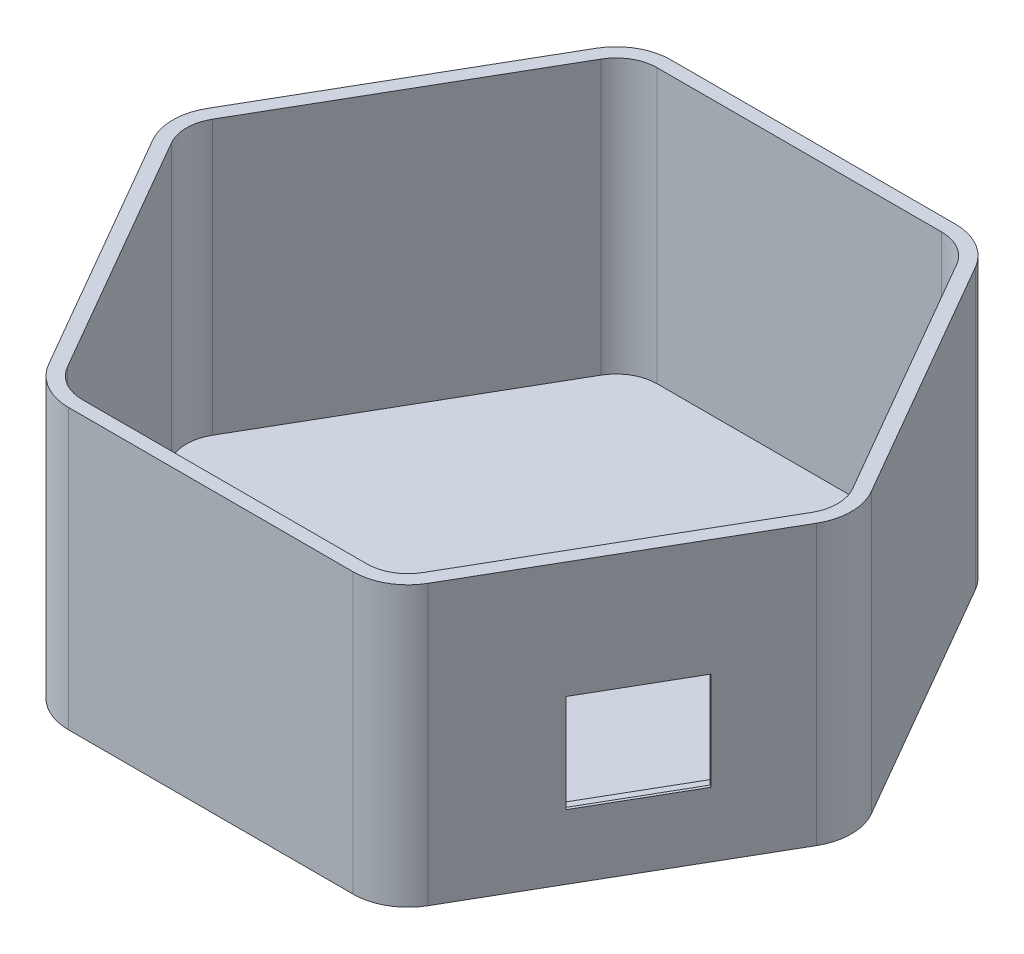
from build123d import *

# Parameters (mm, degrees)
SALIENTE_EXTRUIR1_DEPTH = 2
SALIENTE_EXTRUIR2_DEPTH = 100
CROQUIS3_W              = 58.7
CROQUIS3_H              = 38.2
CROQUIS3_R              = 1.5
CROQUIS3_W_2            = 38.8
CROQUIS3_H_2            = 35.8
CORTAR_EXTRUIR1_DEPTH   = 1
CROQUIS4_W              = 38.8
CROQUIS4_H              = 35.8
CORTAR_EXTRUIR2_DEPTH   = 12
CROQUIS5_W              = 58.7
CROQUIS5_H              = 38.2
CROQUIS5_R              = 1.5
CORTAR_EXTRUIR3_DEPTH   = 3
CROQUIS6_R              = 1
SALIENTE_EXTRUIR3_DEPTH = 3.4
CROQUIS8_R              = 1
CORTAR_EXTRUIR5_DEPTH   = 4
CORTAR_EXTRUIR6_DEPTH   = 0.6


with BuildPart() as part:
    # Croquis1 → Saliente-Extruir1 (new body)
    with BuildSketch(Plane(origin=(0, 0, 0), x_dir=(1, 0, 0), z_dir=(0, 1, 0))):
        with BuildLine():
            Line((-121.24355653, -10), (-69.282032303, -100))
            ThreePointArc((-69.282032303, -100), (-61.961524227, -107.320508076), (-51.961524227, -110))
            Line((-51.961524227, -110), (51.961524227, -110))
            ThreePointArc((51.961524227, -110), (61.961524227, -107.320508076), (69.282032303, -100))
            Line((69.282032303, -100), (121.24355653, -10))
            ThreePointArc((121.24355653, -10), (123.923048454, 0), (121.24355653, 10))
            Line((121.24355653, 10), (69.282032303, 100))
            ThreePointArc((69.282032303, 100), (61.961524227, 107.320508076), (51.961524227, 110))
            Line((51.961524227, 110), (-51.961524227, 110))
            ThreePointArc((-51.961524227, 110), (-61.961524227, 107.320508076), (-69.282032303, 100))
            Line((-69.282032303, 100), (-121.24355653, 10))
            ThreePointArc((-121.24355653, 10), (-123.923048454, 0), (-121.24355653, -10))
        make_face()
    extrude(amount=SALIENTE_EXTRUIR1_DEPTH)

    # Croquis2 → Saliente-Extruir2 (add)
    with BuildSketch(Plane(origin=(0, 2, 0), x_dir=(1, 0, 0), z_dir=(0, 1, 0))):
        with BuildLine():
            Line((-69.282032303, 100), (-121.24355653, 10))
            ThreePointArc((-121.24355653, 10), (-123.923048454, 0), (-121.24355653, -10))
            Line((-121.24355653, -10), (-69.282032303, -100))
            ThreePointArc((-69.282032303, -100), (-61.961524227, -107.320508076), (-51.961524227, -110))
            Line((-51.961524227, -110), (51.961524227, -110))
            ThreePointArc((51.961524227, -110), (61.961524227, -107.320508076), (69.282032303, -100))
            Line((69.282032303, -100), (121.24355653, -10))
            ThreePointArc((121.24355653, -10), (123.923048454, 0), (121.24355653, 10))
            Line((121.24355653, 10), (69.282032303, 100))
            ThreePointArc((69.282032303, 100), (61.961524227, 107.320508076), (51.961524227, 110))
            Line((51.961524227, 110), (-51.961524227, 110))
            ThreePointArc((-51.961524227, 110), (-61.961524227, 107.320508076), (-69.282032303, 100))
        make_face()
        with BuildLine():
            Line((-64.951905284, 97.5), (-116.913429511, 7.5))
            ThreePointArc((-116.913429511, 7.5), (-118.923048454, 0), (-116.913429511, -7.5))
            Line((-116.913429511, -7.5), (-64.951905284, -97.5))
            ThreePointArc((-64.951905284, -97.5), (-59.461524227, -102.990381057), (-51.961524227, -105))
            Line((-51.961524227, -105), (51.961524227, -105))
            ThreePointArc((51.961524227, -105), (59.461524227, -102.990381057), (64.951905284, -97.5))
            Line((64.951905284, -97.5), (116.913429511, -7.5))
            ThreePointArc((116.913429511, -7.5), (118.923048454, 0), (116.913429511, 7.5))
            Line((116.913429511, 7.5), (64.951905284, 97.5))
            ThreePointArc((64.951905284, 97.5), (59.461524227, 102.990381057), (51.961524227, 105))
            Line((51.961524227, 105), (-51.961524227, 105))
            ThreePointArc((-51.961524227, 105), (-59.461524227, 102.990381057), (-64.951905284, 97.5))
        make_face(mode=Mode.SUBTRACT)
    extrude(amount=SALIENTE_EXTRUIR2_DEPTH)

    # Croquis3 → Cortar-Extruir1 (cut)
    with BuildSketch(Plane(origin=(90.932667397, 0, 52.5), x_dir=(-0.49999999999999983, 0, 0.8660254037844387), z_dir=(-0.8660254037844387, 0, -0.49999999999999983))):
        with Locations((-1.426190801, 41.535179267)):
            Rectangle(CROQUIS3_W, CROQUIS3_H)
        with Locations((24.923809199, 57.635179267)):
            Circle(CROQUIS3_R, mode=Mode.SUBTRACT)
        with Locations((24.923809199, 25.435179267)):
            Circle(CROQUIS3_R, mode=Mode.SUBTRACT)
        with Locations((-27.776190801, 25.435179267)):
            Circle(CROQUIS3_R, mode=Mode.SUBTRACT)
        with Locations((-27.776190801, 57.635179267)):
            Circle(CROQUIS3_R, mode=Mode.SUBTRACT)
        with Locations((-4.376190801, 41.535179267)):
            Rectangle(CROQUIS3_W_2, CROQUIS3_H_2, mode=Mode.SUBTRACT)
    extrude(amount=-CORTAR_EXTRUIR1_DEPTH, mode=Mode.SUBTRACT)

    # Croquis4 → Cortar-Extruir2 (cut)
    with BuildSketch(Plane(origin=(90.932667397, 0, 52.5), x_dir=(-0.49999999999999983, 0, 0.8660254037844387), z_dir=(-0.8660254037844387, 0, -0.49999999999999983))):
        with Locations((-4.376190801, 41.535179267)):
            Rectangle(CROQUIS4_W, CROQUIS4_H)
    extrude(amount=-CORTAR_EXTRUIR2_DEPTH, mode=Mode.SUBTRACT)

    # Croquis5 → Cortar-Extruir3 (cut)
    with BuildSketch(Plane(origin=(91.798692801, 0, 53), x_dir=(-0.5, 0, 0.8660254037844386), z_dir=(-0.8660254037844387, 0, -0.5000000000000001))):
        with Locations((-1.426190801, 41.535179267)):
            Rectangle(CROQUIS5_W, CROQUIS5_H)
        with Locations((24.923809199, 25.435179267)):
            Circle(CROQUIS5_R, mode=Mode.SUBTRACT)
        with Locations((24.923809199, 57.635179267)):
            Circle(CROQUIS5_R, mode=Mode.SUBTRACT)
        with Locations((-27.776190801, 57.635179267)):
            Circle(CROQUIS5_R, mode=Mode.SUBTRACT)
        with Locations((-27.776190801, 25.435179267)):
            Circle(CROQUIS5_R, mode=Mode.SUBTRACT)
    extrude(amount=-CORTAR_EXTRUIR3_DEPTH, mode=Mode.SUBTRACT)

    # Croquis6 → Saliente-Extruir3 (add)
    # profile 1 of 4: a face of its own
    with BuildSketch(Plane(origin=(94.396769013, 0, 54.5), x_dir=(-0.5000000000000001, 0, 0.8660254037844386), z_dir=(-0.8660254037844386, 0, -0.5000000000000001))):
        with BuildLine():
            Line((-30.776190801, 60.635179267), (-25.776190801, 60.635179267))
            Line((-25.776190801, 60.635179267), (-25.776190801, 56.635179267))
            ThreePointArc((-25.776190801, 56.635179267), (-26.06908402, 55.928072486), (-26.776190801, 55.635179267))
            Line((-26.776190801, 55.635179267), (-30.776190801, 55.635179267))
            Line((-30.776190801, 55.635179267), (-30.776190801, 60.635179267))
        make_face()
        with Locations((-27.776190801, 57.635179267)):
            Circle(CROQUIS6_R, mode=Mode.SUBTRACT)
    # profile 2 of 4: a face of its own
    with BuildSketch(Plane(origin=(94.396769013, 0, 54.5), x_dir=(-0.5000000000000001, 0, 0.8660254037844386), z_dir=(-0.8660254037844386, 0, -0.5000000000000001))):
        with BuildLine():
            Line((-30.776190801, 22.435179267), (-25.776190801, 22.435179267))
            Line((-25.776190801, 22.435179267), (-25.776190801, 26.435179267))
            ThreePointArc((-25.776190801, 26.435179267), (-26.06908402, 27.142286049), (-26.776190801, 27.435179267))
            Line((-26.776190801, 27.435179267), (-30.776190801, 27.435179267))
            Line((-30.776190801, 27.435179267), (-30.776190801, 22.435179267))
        make_face()
        with Locations((-27.776190801, 25.435179267)):
            Circle(CROQUIS6_R, mode=Mode.SUBTRACT)
    # profile 3 of 4: a face of its own
    with BuildSketch(Plane(origin=(94.396769013, 0, 54.5), x_dir=(-0.5000000000000001, 0, 0.8660254037844386), z_dir=(-0.8660254037844386, 0, -0.5000000000000001))):
        with BuildLine():
            Line((27.923809199, 22.435179267), (22.923809199, 22.435179267))
            Line((22.923809199, 22.435179267), (22.923809199, 26.435179267))
            ThreePointArc((22.923809199, 26.435179267), (23.216702418, 27.142286049), (23.923809199, 27.435179267))
            Line((23.923809199, 27.435179267), (27.923809199, 27.435179267))
            Line((27.923809199, 27.435179267), (27.923809199, 22.435179267))
        make_face()
        with Locations((24.923809199, 25.435179267)):
            Circle(CROQUIS6_R, mode=Mode.SUBTRACT)
    # profile 4 of 4: a face of its own
    with BuildSketch(Plane(origin=(94.396769013, 0, 54.5), x_dir=(-0.5000000000000001, 0, 0.8660254037844386), z_dir=(-0.8660254037844386, 0, -0.5000000000000001))):
        with BuildLine():
            Line((27.923809199, 60.635179267), (22.923809199, 60.635179267))
            Line((22.923809199, 60.635179267), (22.923809199, 56.635179267))
            ThreePointArc((22.923809199, 56.635179267), (23.216702418, 55.928072486), (23.923809199, 55.635179267))
            Line((23.923809199, 55.635179267), (27.923809199, 55.635179267))
            Line((27.923809199, 55.635179267), (27.923809199, 60.635179267))
        make_face()
        with Locations((24.923809199, 57.635179267)):
            Circle(CROQUIS6_R, mode=Mode.SUBTRACT)
    extrude(amount=SALIENTE_EXTRUIR3_DEPTH)

    # Croquis8 → Cortar-Extruir5 (cut)
    with BuildSketch(Plane(origin=(90.932667397, 0, 52.5), x_dir=(-0.49999999999999983, 0, 0.8660254037844387), z_dir=(-0.8660254037844387, 0, -0.49999999999999983))):
        with Locations((-27.776190801, 57.635179267)):
            Circle(CROQUIS8_R)
        with Locations((-27.776190801, 25.435179267)):
            Circle(CROQUIS8_R)
        with Locations((24.923809199, 25.435179267)):
            Circle(CROQUIS8_R)
        with Locations((24.923809199, 57.635179267)):
            Circle(CROQUIS8_R)
    extrude(amount=-CORTAR_EXTRUIR5_DEPTH, mode=Mode.SUBTRACT)

    # Croquis10 → Cortar-Extruir6 (cut)
    with BuildSketch(Plane(origin=(90.932667397, 0, 52.5), x_dir=(-0.49999999999999983, 0, 0.8660254037844387), z_dir=(-0.8660254037844387, 0, -0.49999999999999983))):
        Polygon((27.923809199, 22.435179267), (27.923809199, 60.635179267), (-30.776190801, 60.635179267), (-30.776190801, 55.635179267), (-30.776190801, 27.435179267), (-30.776190801, 22.435179267), align=None)
    extrude(amount=-CORTAR_EXTRUIR6_DEPTH, mode=Mode.SUBTRACT)


solid = part.part
